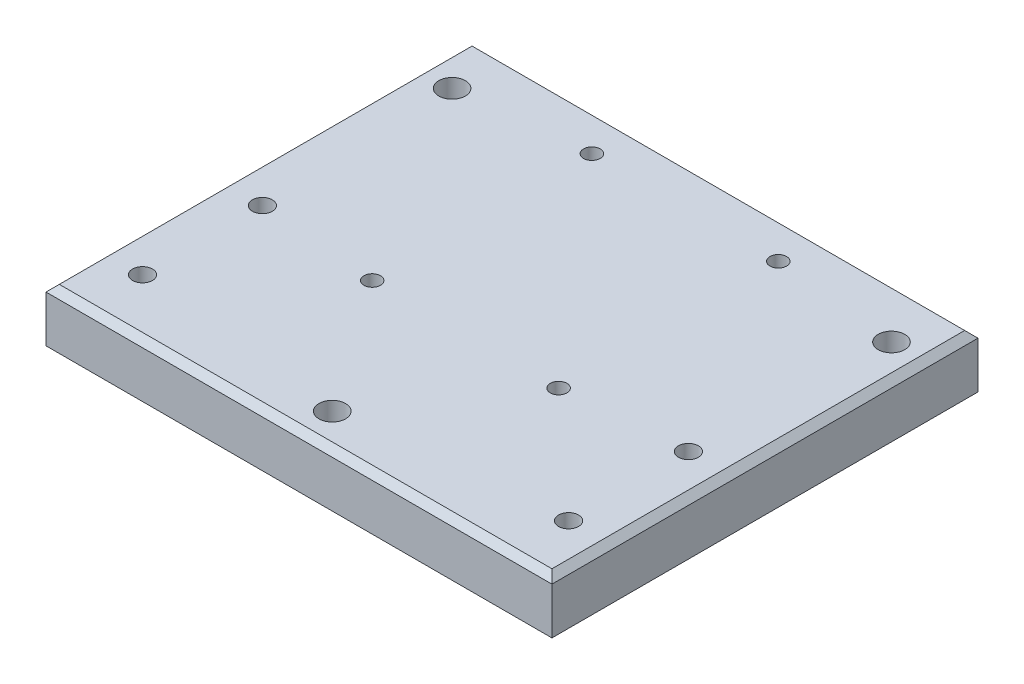
from build123d import *

# Parameters (mm, degrees)
SKETCH1_W            = 76
SKETCH1_H            = 64
BOSS_EXTRUDE1_DEPTH  = 8
M3_TAPPED_HOLE1_D    = 2.5
LPATTERN2_COUNT      = 2
LPATTERN2_PITCH      = 28
LPATTERN2_COUNT_DIR2 = 2
LPATTERN2_PITCH_DIR2 = 33
SKETCH5_R            = 2
CUT_EXTRUDE1_DEPTH   = 51.318982502
CHAMFER1_SIZE        = 1
SKETCH6_R            = 1.5
CUT_EXTRUDE2_DEPTH   = 10


with BuildPart() as part:
    # Sketch1 → Boss-Extrude1 (new body)
    with BuildSketch(Plane(origin=(0, 0, 0), x_dir=(1, 0, 0), z_dir=(0, 1, 0))):
        Rectangle(SKETCH1_W, SKETCH1_H)
    extrude(amount=BOSS_EXTRUDE1_DEPTH)

    # M3 Tapped Hole1 (through all)
    with Locations(Plane(origin=(0, 8, 0), x_dir=(1, 0, 0), z_dir=(0, 1, 0))):
        with Locations((-14, 26)):
            m3_tapped_hole1 = Hole(M3_TAPPED_HOLE1_D / 2)

    # LPattern2: M3 Tapped Hole1 2 × 2
    with Locations(*[(i * LPATTERN2_PITCH, 0, j * LPATTERN2_PITCH_DIR2) for i in range(LPATTERN2_COUNT) for j in range(LPATTERN2_COUNT_DIR2) if (i, j) != (0, 0)]):
        add(m3_tapped_hole1, mode=Mode.SUBTRACT)

    # Sketch5 → Cut-Extrude1 (cut, through all)
    with BuildSketch(Plane(origin=(0, 8, 0), x_dir=(1, 0, 0), z_dir=(0, 1, 0))):
        with Locations(Location((-33, 24, 0), (0, 0, 270))):
            Circle(SKETCH5_R)
        with Locations(Location((33, 24, 0), (0, 0, 270))):
            Circle(SKETCH5_R)
        with Locations(Location((0, -27, 0), (0, 0, 270))):
            Circle(SKETCH5_R)
    extrude(amount=-CUT_EXTRUDE1_DEPTH, mode=Mode.SUBTRACT)

    # Chamfer1
    chamfer1_edges = [part.edges().sort_by_distance(p)[0] for p in [
        (-38, 8, 0),
        (0, 8, 32),
        (38, 8, 0),
        (0, 8, -32),
    ]]
    chamfer(chamfer1_edges, length=CHAMFER1_SIZE)

    # Sketch6 → Cut-Extrude2 (cut)
    with BuildSketch(Plane(origin=(0, 8, 0), x_dir=(1, 0, 0), z_dir=(0, 1, 0))):
        with Locations(Location((32, -5.5, 0), (0, 0, 270))):
            Circle(SKETCH6_R)
        with Locations(Location((32, -23.5, 0), (0, 0, 270))):
            Circle(SKETCH6_R)
        with Locations(Location((-32, -23.5, 0), (0, 0, 270))):
            Circle(SKETCH6_R)
        with Locations(Location((-32, -5.5, 0), (0, 0, 270))):
            Circle(SKETCH6_R)
    extrude(amount=-CUT_EXTRUDE2_DEPTH, mode=Mode.SUBTRACT)


solid = part.part
